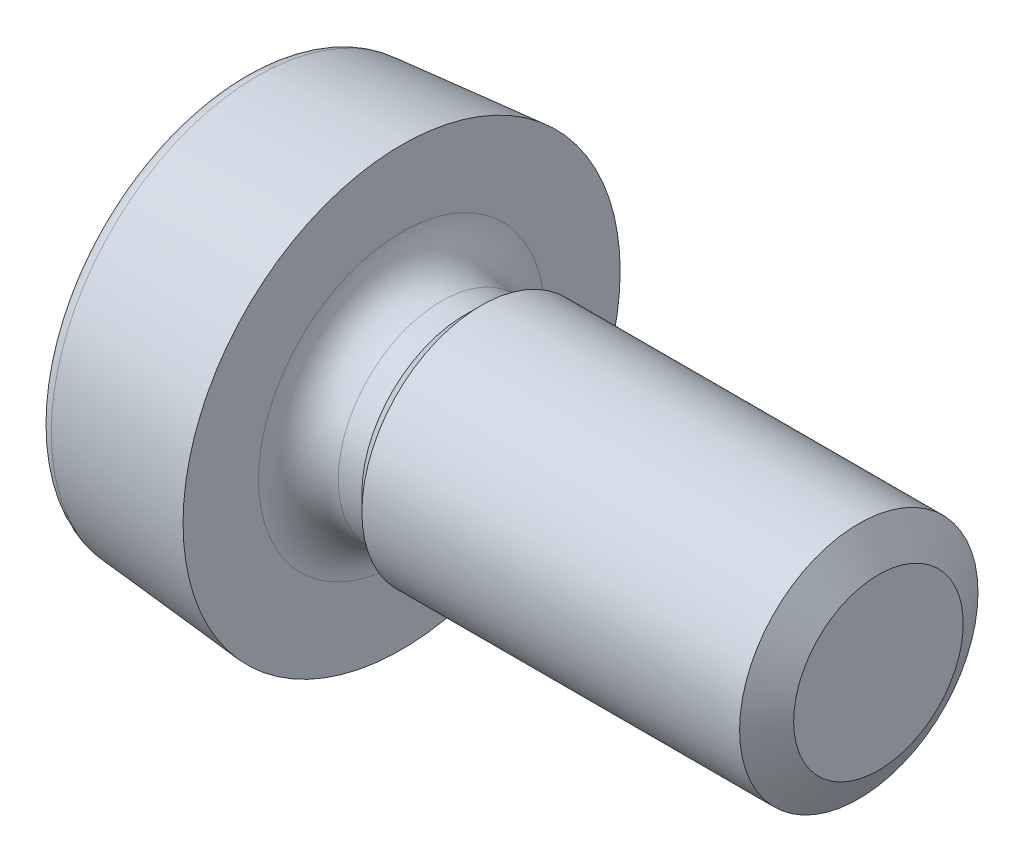
from build123d import *

# Parameters (mm, degrees)
PATTERN_CIRCULAR_1_COUNT = 2
PATTERN_CIRCULAR_1_ANGLE = 90


with BuildPart() as part:
    # 草图3 → Revolve 850 (revolve)
    with BuildSketch(Plane.XY, mode=Mode.PRIVATE) as revolve_850_sk:
        with BuildLine():
            Line((0, 0), (8, 0))
            Line((8, 0), (8, 1.5))
            Line((8, 1.5), (3, 1.5))
            Line((3, 1.5), (2.799, 1.299))
            Line((2.799, 1.299), (2.501, 1.299))
            ThreePointArc((2.501, 1.299), (2.146739503, 1.445739503), (2, 1.8))
            Line((2, 1.8), (2, 2.75))
            Line((2, 2.75), (0.182568851, 2.590995378))
            ThreePointArc((0.182568851, 2.590995378), (0.052544533, 2.52687448), (0, 2.391756438))
            Line((0, 2.391756438), (0, 0))
        make_face()
    revolve(revolve_850_sk.sketch.rotate(Axis((-2.16958059, 0, 0), (1, 0, 0)), 90), axis=Axis((-2.16958059, 0, 0), (1, 0, 0)))

    # 草图4 → 切除-旋转1 (revolve, cut)
    with BuildSketch(Plane.XY, mode=Mode.PRIVATE) as cut_revolve_1_sk:
        Polygon((7.752708003, 1.5), (8.252708003, 1.5), (8, 1.067), align=None)
    revolve(cut_revolve_1_sk.sketch.rotate(Axis((-0.21798541, 0, 0), (1, 0, 0)), 90), axis=Axis((-0.21798541, 0, 0), (1, 0, 0)), mode=Mode.SUBTRACT)

    # 草图5 → 切除-放样1 section 0
    with BuildSketch(Plane.ZY, mode=Mode.PRIVATE) as loft_1_s0:
        with BuildLine():
            Line((-0.25, 1.75), (0.25, 1.75))
            Line((0.25, 1.75), (0.25, -1.75))
            Line((0.25, -1.75), (-0.25, -1.75))
            Line((-0.25, -1.75), (-0.25, 1.75))
        make_face()
    loft_1 = loft([loft_1_s0.sketch, Vertex(0.86, 0, 0)], mode=Mode.SUBTRACT)

    # 阵列(圆周)1: 切除-放样1 ×2 about axis
    pattern_circular_1_axis = Axis((0, 0, 0), (1, 0, 0))
    for i in range(1, PATTERN_CIRCULAR_1_COUNT):
        add(loft_1.rotate(pattern_circular_1_axis, i * PATTERN_CIRCULAR_1_ANGLE / (PATTERN_CIRCULAR_1_COUNT - 1)), mode=Mode.SUBTRACT)


solid = part.part
